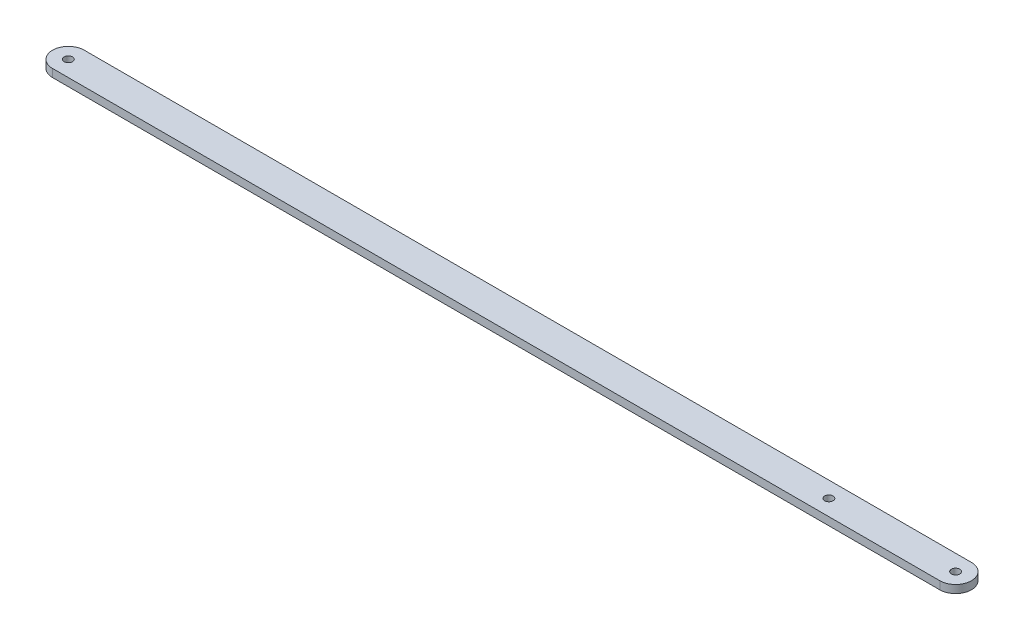
from build123d import *

# Parameters (mm, degrees)
SKETCH1_R           = 3.3655
BOSS_EXTRUDE1_DEPTH = 6.35


with BuildPart() as part:
    # Sketch1 → Boss-Extrude1 (new body)
    with BuildSketch(Plane(origin=(0, 0, 0), x_dir=(1, 0, 0), z_dir=(0, 1, 0))):
        with BuildLine():
            Line((-355.6, 12.7), (355.6, 12.7))
            ThreePointArc((355.6, 12.7), (368.3, 0), (355.6, -12.7))
            Line((355.6, -12.7), (-355.6, -12.7))
            ThreePointArc((-355.6, -12.7), (-368.3, 0), (-355.6, 12.7))
        make_face()
        with Locations(Location((355.6, 0, 0), (0, 0, 270))):
            Circle(SKETCH1_R, mode=Mode.SUBTRACT)
        with Locations(Location((254, 0, 0), (0, 0, 270))):
            Circle(SKETCH1_R, mode=Mode.SUBTRACT)
        with Locations(Location((-355.6, 0, 0), (0, 0, 270))):
            Circle(SKETCH1_R, mode=Mode.SUBTRACT)
    extrude(amount=BOSS_EXTRUDE1_DEPTH)


solid = part.part
